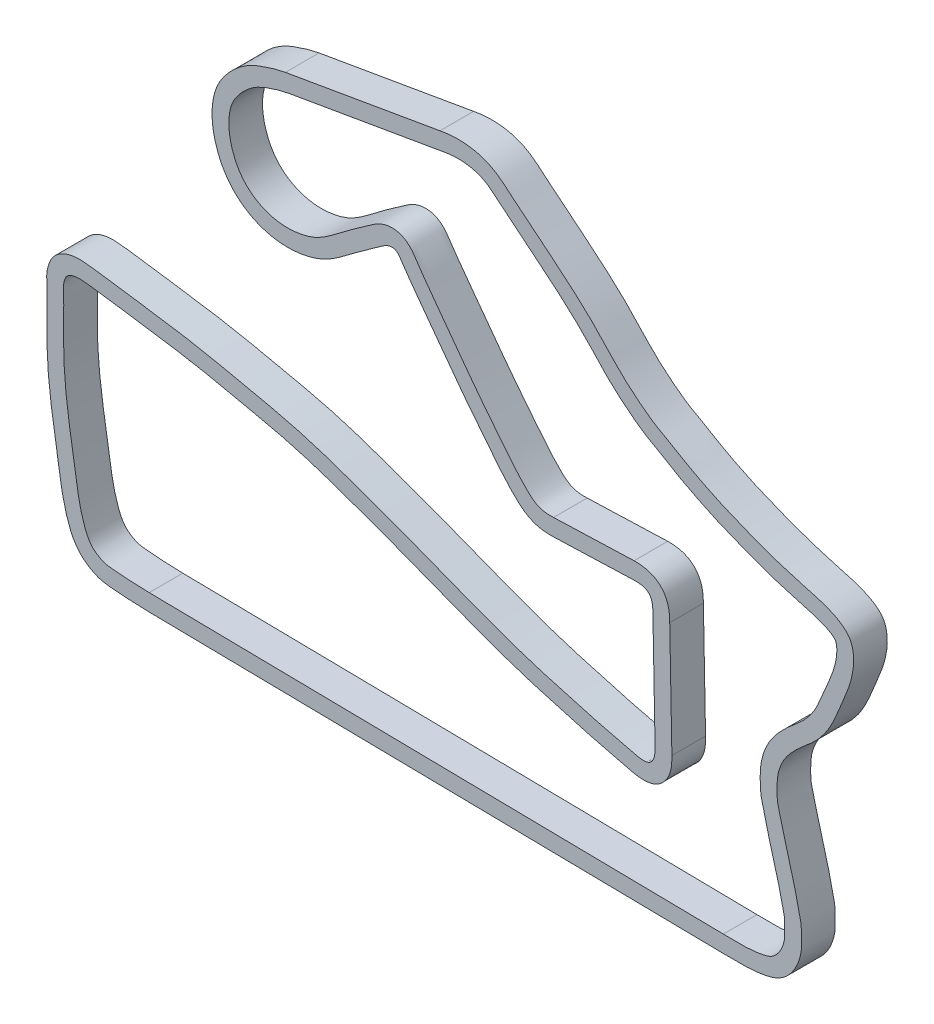
from build123d import *

# Parameters (mm, degrees)
BOSS_EXTRUDE1_DEPTH = 25.4
SCALE1_SCALE        = 1.5


with BuildPart() as part:
    # Sketch1 → Boss-Extrude1 (new body)
    with BuildSketch(Plane.XY):
        with BuildLine():
            Line((510.948052258, 0), (77.568867003, 6.513353528))
            add(Edge.make_bspline(
                [(77.568867003, 6.513353528), (69.030728587, 6.641675137), (55.964005037, 7.369579283), (40.619041764, 8.962681121), (32.520389831, 13.062197763), (22.340509454, 20.632128838), (13.37293322, 40.995751909), (9.64727267, 68.132555503), (4.518112533, 98.566856348), (0.888212171, 127.345546067), (0.243313676, 155.813105447), (0.796433318, 176.596094605), (0.231593183, 189.683032719), (1.817976997, 195.772330326), (3.969365909, 201.111279782), (8.445075768, 206.051727156), (15.426999324, 209.808150677), (25.187426391, 211.339964649), (48.241253614, 208.234524629), (77.101494294, 204.087879138), (114.230932258, 198.475524376), (150.520531401, 190.553781654), (190.249150629, 182.194634337), (246.070987082, 163.295131018), (294.761597926, 144.48794029), (340.355184506, 126.646570623), (368.949494388, 116.994564879), (398.232954792, 108.82512586), (423.483106585, 101.891766343), (439.265784543, 98.319066993), (447.287916927, 96.186627876), (451.586233083, 95.942868872), (456.007298367, 96.71723885), (459.710546879, 101.967401294), (459.673627387, 107.096180764), (459.622470964, 109.787147582)],
                knots=[0, 0, 0, 0, 0.037553743, 0.051675274, 0.06341315, 0.074522355, 0.103523939, 0.15100199, 0.188457487, 0.230816561, 0.270760544, 0.305807001, 0.316980103, 0.3244308, 0.331625629, 0.340566304, 0.351322267, 0.363770868, 0.380669469, 0.446973148, 0.484528158, 0.535660665, 0.600414836, 0.652006859, 0.778824976, 0.816085081, 0.854228161, 0.903418232, 0.941675071, 0.962299193, 0.97037132, 0.975801833, 0.980081757, 0.988237124, 1, 1, 1, 1], degree=3))
            Line((459.622470964, 109.787147582), (457.987392708, 195.796705296))
            add(Edge.make_bspline(
                [(457.987392708, 195.796705296), (457.967490098, 196.843636645), (457.891662231, 198.896187568), (457.622623229, 201.827375913), (456.841412297, 204.671863441), (455.213625657, 207.490902585), (452.287680225, 209.324394914), (448.50392316, 210.233281687), (445.799968277, 210.415413959), (444.208360226, 210.360282958)],
                knots=[0, 0, 0, 0, 0.133759242, 0.259768248, 0.37304448, 0.506547964, 0.662787354, 0.794589909, 1, 1, 1, 1], degree=3))
            Line((444.208360226, 210.360282958), (383.443399876, 208.255472584))
            add(Edge.make_bspline(
                [(383.443399876, 208.255472584), (380.654226775, 208.15885966), (375.280764537, 208.163684824), (368.045334419, 209.957056426), (362.170112945, 212.983787892), (357.684334704, 216.390098997), (348.113215785, 225.347373543), (338.01326167, 237.992346732), (324.805335562, 254.602800783), (312.246963495, 270.660217661), (298.545736406, 289.442546536), (284.590190359, 308.224393568), (274.527618279, 321.963789608), (268.593941791, 330.548653617), (266.155483312, 334.362737176), (263.593299438, 336.497895803), (260.420108869, 336.858659488), (256.39910491, 335.719713316), (250.553914429, 331.361866757), (242.307412942, 325.802938943), (227.864562545, 315.24259751), (213.952537761, 303.809529439), (192.000062158, 296.908188226), (171.08149331, 296.360499132), (150.238977452, 305.175550348), (135.871318743, 318.917286155), (126.943320823, 337.291444998), (124.032158765, 357.594312144), (127.954304381, 376.191172031), (138.033269758, 390.521313405), (151.276548221, 401.562382496), (166.686521311, 407.312033441), (176.222002931, 409.941038251), (180.596038986, 410.696409758)],
                knots=[0, 0, 0, 0, 0.018810889, 0.03554016, 0.049383709, 0.062730234, 0.073095707, 0.13702697, 0.170537904, 0.215175917, 0.273365218, 0.326069889, 0.371729283, 0.387280673, 0.395894573, 0.40198787, 0.408845865, 0.416254491, 0.429510372, 0.457056778, 0.483027139, 0.549403055, 0.57496845, 0.635951455, 0.684859285, 0.72240142, 0.766603351, 0.819026654, 0.85694758, 0.890594014, 0.93445833, 0.969956567, 1, 1, 1, 1], degree=3))
            Line((180.596038986, 410.696409758), (297.281003035, 430.847248938))
            add(Edge.make_bspline(
                [(297.281003035, 430.847248938), (300.034357121, 431.322737754), (306.603516737, 432.346299455), (316.916246984, 432.245606968), (328.463277027, 430.166073006), (340.273379495, 424.935961335), (354.848764078, 411.909311159), (375.404197197, 395.575288586), (397.73116387, 377.218326557), (418.162331408, 357.954190535), (432.029256665, 341.846826249), (447.325447689, 328.821935975), (459.184433634, 319.831044682), (471.65903681, 313.514496614), (480.194498146, 308.296774442), (487.526117908, 303.872620687), (495.840819778, 299.725991428), (506.762410547, 294.195534394), (531.087772775, 283.934775855), (559.595055945, 273.36219233), (587.832661316, 266.798602429), (600.799391745, 260.166074984), (607.055472768, 253.834751887), (609.561604572, 245.877036708), (609.673062989, 236.021877094), (606.677781579, 222.094884874), (600.265705095, 207.771615283), (594.883618797, 194.295463346), (588.639541784, 182.635257129), (579.781471959, 171.977727336), (569.572098995, 164.231918965), (562.566691985, 157.06555921), (558.130924613, 151.848679425), (554.851305595, 145.800111699), (551.915420971, 137.970335053), (551.56761943, 129.123301291), (551.742066227, 119.157654193), (554.175446648, 111.369336951), (556.801225502, 100.231330927), (560.757801353, 85.134073054), (565.586299765, 68.767121719), (568.235700017, 55.948491994), (570.157436182, 47.920362657), (570.043428432, 40.359634956), (570.468170493, 32.054965541), (568.446302353, 23.756378752), (565.074127328, 16.39731597), (559.983589885, 9.554118765), (552.489040221, 3.880670293), (543.093075462, 1.411022084), (529.190090122, -0.441241168), (518.595728753, -0.114938655), (510.948052258, 0)],
                knots=[0, 0, 0, 0, 0.0122747, 0.029125367, 0.04500914, 0.063545861, 0.084923288, 0.130314231, 0.179055588, 0.211691381, 0.25352597, 0.27204927, 0.299843856, 0.318569353, 0.333311676, 0.343765783, 0.356145831, 0.374083225, 0.397503071, 0.472003458, 0.507370569, 0.524214459, 0.535352764, 0.545335874, 0.559970477, 0.578222887, 0.607407655, 0.628665351, 0.641923049, 0.66534492, 0.68877601, 0.697981987, 0.709327812, 0.718686907, 0.728065134, 0.745775031, 0.757063316, 0.771668458, 0.781283631, 0.807363115, 0.840162181, 0.856109978, 0.864893489, 0.876245051, 0.889154013, 0.901241586, 0.913299075, 0.924502134, 0.938411877, 0.953595749, 0.966528787, 1, 1, 1, 1], degree=3))
        make_face()
        with BuildLine():
            Line((511.13890187, 12.69856592), (77.759716614, 19.211919448))
            add(Edge.make_bspline(
                [(77.759716614, 19.211919448), (76.900187637, 19.224837503), (75.196484109, 19.258428994), (71.667894876, 19.358907419), (67.14494168, 19.544205338), (62.51141537, 19.805373157), (58.781490632, 20.057073316), (55.976679843, 20.266538582), (53.191893239, 20.495941716), (50.368986188, 20.744621678), (47.926208197, 21.00125836), (45.89002905, 21.316358467), (44.537827154, 21.635998419), (43.659684698, 21.913908674), (42.695256641, 22.275130119), (41.382392445, 22.876591141), (39.949188326, 23.676396867), (38.742966589, 24.428003032), (37.624267557, 25.17412558), (36.374228779, 26.109737694), (35.361342747, 27.013250172), (34.665914078, 27.732582794), (33.611629618, 28.934811625), (32.078897563, 31.131898644), (30.176864869, 34.921367161), (28.478043374, 39.409796012), (26.975094987, 44.305885307), (25.714430135, 49.270355901), (24.267553429, 56.098940403), (23.08659907, 63.209849999), (21.960236521, 70.613353778), (20.782440028, 78.186003573), (19.269555092, 87.526081779), (16.939940291, 102.320774916), (14.99122472, 116.924620528), (13.785185068, 131.349212059), (13.294861216, 142.257588427), (13.154680282, 151.4465668), (13.171902076, 158.815431895), (13.230958635, 164.428983577), (13.291036057, 170.142330198), (13.306329744, 174.987229109), (13.273871885, 178.922861692), (13.231298764, 181.393743011), (13.177640098, 183.4120204), (13.125849131, 185.225541961), (13.113069224, 186.735581431), (13.164206275, 187.927797403), (13.230604752, 188.655227819), (13.319662193, 189.248626867), (13.471446656, 189.981809608), (13.681655533, 190.786937932), (13.962039468, 191.699427306), (14.277253478, 192.606690638), (14.55074403, 193.285904798), (14.796575145, 193.798366106), (14.962939796, 194.08829202), (15.166046423, 194.386209776), (15.532181549, 194.839923233), (16.148415726, 195.450095328), (17.394085725, 196.376883076), (18.975665604, 197.147856063), (20.861150204, 197.681086507), (23.03516346, 198.063756739), (26.081890211, 198.198399976), (29.859474952, 197.876751932), (33.325010287, 197.426373604), (37.095669461, 196.908088847), (41.760400906, 196.266908234), (47.370309762, 195.484361317), (54.836569312, 194.432188129), (64.162868413, 193.097381099), (75.34364728, 191.465424047), (86.546512371, 189.809904362), (97.648653251, 188.114070007), (108.590427535, 186.281483905), (123.102431508, 183.511373175), (137.786437293, 180.349776496), (152.631579571, 177.170097517), (167.286025009, 173.98431908), (181.684186483, 170.580486737), (195.697018032, 166.612298323), (209.743953621, 162.192254042), (227.407390497, 156.056122324), (248.617019222, 148.373858245), (269.747960345, 140.445724199), (287.338402574, 133.688784732), (301.416476219, 128.225032065), (311.962468764, 124.111279827), (322.586150662, 119.968223694), (333.359025168, 115.878408796), (344.291528017, 111.956096465), (355.275782909, 108.258745537), (366.341274808, 104.772547584), (377.398911339, 101.503977267), (386.587378814, 98.902479965), (393.917606215, 96.863706199), (399.394147882, 95.348706888), (404.90064869, 93.832836802), (410.440357636, 92.331196738), (416.017331438, 90.856690538), (421.626534942, 89.422750297), (426.353506779, 88.273838526), (430.055777624, 87.397285734), (432.798591233, 86.747521145), (435.497047693, 86.099877859), (437.734473452, 85.548975861), (439.459122456, 85.11073203), (440.922822041, 84.735616133), (442.585008413, 84.335750517), (444.445657923, 83.946570826), (446.522516147, 83.610931582), (448.788565614, 83.385978261), (450.82688224, 83.335437863), (452.525563882, 83.405198743), (453.859107922, 83.518684684), (455.415477321, 83.73955136), (457.169141272, 84.12716271), (459.110926045, 84.746783932), (461.265166142, 85.738959372), (463.160843302, 86.939107277), (465.349098553, 88.704810902), (467.481192952, 91.087721412), (469.302278474, 93.976487125), (470.594601855, 96.847015564), (471.456712795, 99.643231644), (471.966384903, 102.231160851), (472.231282001, 104.585528796), (472.335226637, 106.688752491), (472.345225884, 108.21621101), (472.333364108, 109.309541154), (472.32484904, 109.782759602), (472.320176719, 110.028536366)],
                knots=[0, 0, 0, 0, 0.00390625, 0.0078125, 0.015625, 0.0234375, 0.02734375, 0.03125, 0.03515625, 0.0390625, 0.04296875, 0.046875, 0.05078125, 0.052734375, 0.0546875, 0.05859375, 0.0625, 0.064453125, 0.06640625, 0.0703125, 0.07421875, 0.076171875, 0.078125, 0.0859375, 0.09375, 0.1015625, 0.109375, 0.1171875, 0.125, 0.140625, 0.1484375, 0.15625, 0.171875, 0.1875, 0.21875, 0.234375, 0.25, 0.265625, 0.2734375, 0.28125, 0.2890625, 0.296875, 0.30078125, 0.3046875, 0.306640625, 0.30859375, 0.3125, 0.314453125, 0.31640625, 0.318359375, 0.3203125, 0.322265625, 0.32421875, 0.326171875, 0.328125, 0.330078125, 0.33203125, 0.333984375, 0.3359375, 0.33984375, 0.34375, 0.3515625, 0.35546875, 0.359375, 0.3671875, 0.375, 0.37890625, 0.3828125, 0.390625, 0.3984375, 0.40625, 0.421875, 0.4375, 0.453125, 0.46875, 0.484375, 0.5, 0.53125, 0.546875, 0.5625, 0.59375, 0.609375, 0.625, 0.65625, 0.6875, 0.71875, 0.75, 0.765625, 0.78125, 0.796875, 0.8125, 0.828125, 0.84375, 0.859375, 0.875, 0.890625, 0.8984375, 0.90625, 0.9140625, 0.921875, 0.9296875, 0.9375, 0.9453125, 0.94921875, 0.953125, 0.95703125, 0.9609375, 0.962890625, 0.96484375, 0.966796875, 0.96875, 0.970703125, 0.97265625, 0.974609375, 0.975585938, 0.9765625, 0.977539062, 0.978515625, 0.979492188, 0.98046875, 0.981445312, 0.982421875, 0.984375, 0.986328125, 0.98828125, 0.990234375, 0.9921875, 0.994140625, 0.99609375, 0.998046875, 0.999023438, 1, 1, 1, 1], degree=3))
            Line((472.320176719, 110.028536366), (470.685098463, 196.03809408))
            add(Edge.make_bspline(
                [(470.685098463, 196.03809408), (470.662981455, 197.201508793), (470.603018685, 198.862493045), (470.421037485, 201.407622173), (470.126740268, 203.786867598), (469.544090522, 206.490968681), (468.593446114, 209.335150094), (467.374060337, 211.85119163), (466.012016905, 213.934975867), (464.755639118, 215.511553604), (463.271586847, 217.008718235), (461.26283395, 218.655411384), (458.699753389, 220.228375533), (455.613617819, 221.513941384), (453.297265167, 222.140310224), (451.66001998, 222.472435731), (450.173575148, 222.72131953), (447.53702416, 223.040698471), (445.275545364, 223.104865341), (443.768714258, 223.05267089)],
                knots=[0, 0, 0, 0, 0.125, 0.1875, 0.25, 0.3125, 0.375, 0.4375, 0.46875, 0.5, 0.53125, 0.5625, 0.625, 0.6875, 0.75, 0.78125, 0.8125, 0.875, 1, 1, 1, 1], degree=3))
            Line((443.768714258, 223.05267089), (383.003753909, 220.947860516))
            add(Edge.make_bspline(
                [(383.003753909, 220.947860516), (382.502580473, 220.930500593), (381.478331168, 220.902883149), (379.601879017, 220.895623584), (377.479076432, 220.990303713), (375.387100076, 221.284104517), (373.345276027, 221.802436885), (371.501072328, 222.50645579), (368.970372948, 223.815825554), (366.425306015, 225.666296009), (363.662186213, 228.180412411), (360.658912003, 231.138818527), (357.043529085, 235.005453533), (352.745909677, 240.002412182), (348.474428332, 245.248230817), (344.124520919, 250.716881773), (339.770926033, 256.188523462), (335.445961336, 261.651613226), (329.715829332, 268.938139448), (322.711076739, 278.016622487), (315.847248775, 287.286251788), (310.324826019, 294.803310867), (306.149409418, 300.473561368), (301.97500352, 306.116665389), (297.809396426, 311.744615054), (294.348581649, 316.429343146), (291.598227007, 320.16728521), (289.550219373, 322.96466121), (287.519253012, 325.75849576), (285.507575008, 328.551303828), (283.520714304, 331.341861501), (281.879212248, 333.676809717), (280.609923199, 335.510272541), (279.837568132, 336.643502683), (279.231946745, 337.545766364), (278.787979425, 338.21378769), (278.33889029, 338.900891711), (277.512825636, 340.145409786), (276.344625944, 341.772618647), (274.686142708, 343.626212436), (273.089821334, 345.123666491), (271.350891013, 346.408077964), (269.66972178, 347.371005159), (267.738546398, 348.261452043), (265.382424025, 348.974463051), (262.76455346, 349.358609994), (260.362774953, 349.403621073), (257.397998128, 349.129982003), (254.10443553, 348.298431809), (250.84296524, 346.889573119), (248.251998896, 345.379889653), (246.579196387, 344.231985824), (245.473467641, 343.43813671), (244.775979766, 342.932131474), (244.11266301, 342.456024074), (243.205850632, 341.810278709), (242.061947913, 341.00473983), (240.663823602, 340.030306782), (238.770452303, 338.718509163), (236.352380281, 337.047866658), (233.371548798, 334.954533123), (230.42341795, 332.832063733), (227.498378765, 330.68058667), (223.601609148, 327.750853401), (218.938739, 324.151895537), (213.632623677, 320.216489474), (208.530267502, 316.84555457), (204.428884681, 314.639956445), (201.183629814, 313.268574431), (197.731294573, 312.057559302), (193.104944962, 310.870017792), (185.499365823, 309.723785789), (177.896298387, 309.803438272), (170.678465931, 311.155426638), (165.436476263, 312.825605755), (160.471948996, 315.120659682), (155.913887795, 317.984868051), (151.781414515, 321.422243105), (148.164394615, 325.348458955), (145.136737125, 329.700750574), (141.719127198, 336.239767159), (138.688617922, 345.510022405), (137.690203905, 354.839133572), (138.213252244, 362.193097538), (139.099815074, 366.477118459), (140.142813165, 369.62242127), (141.377802802, 372.5059434), (143.501284809, 376.112981914), (146.392290919, 379.745526871), (149.007673301, 382.529277794), (151.726899702, 385.120514926), (154.609031161, 387.42827164), (157.617565938, 389.408235423), (160.666134333, 391.14006357), (164.953733298, 393.071926594), (169.874412073, 394.7914917), (174.031306621, 396.08673725), (177.033021408, 396.933601401), (179.468403231, 397.529314951), (181.369304195, 397.929625993), (182.291173013, 398.101162909), (182.757267024, 398.181654732)],
                knots=[0, 0, 0, 0, 0.00390625, 0.0078125, 0.015625, 0.0234375, 0.03125, 0.0390625, 0.046875, 0.0625, 0.0703125, 0.078125, 0.09375, 0.109375, 0.125, 0.140625, 0.15625, 0.171875, 0.1875, 0.21875, 0.25, 0.265625, 0.28125, 0.296875, 0.3125, 0.328125, 0.3359375, 0.34375, 0.3515625, 0.359375, 0.3671875, 0.375, 0.37890625, 0.3828125, 0.384765625, 0.38671875, 0.388671875, 0.390625, 0.39453125, 0.396484375, 0.3984375, 0.400390625, 0.401367188, 0.40234375, 0.404296875, 0.40625, 0.408203125, 0.41015625, 0.4140625, 0.41796875, 0.421875, 0.42578125, 0.427734375, 0.4296875, 0.431640625, 0.43359375, 0.4375, 0.44140625, 0.4453125, 0.453125, 0.4609375, 0.46875, 0.4765625, 0.484375, 0.5, 0.515625, 0.53125, 0.546875, 0.5546875, 0.5625, 0.578125, 0.59375, 0.625, 0.640625, 0.65625, 0.671875, 0.6875, 0.703125, 0.71875, 0.734375, 0.75, 0.78125, 0.8125, 0.828125, 0.84375, 0.8515625, 0.859375, 0.875, 0.890625, 0.8984375, 0.90625, 0.921875, 0.9296875, 0.9375, 0.953125, 0.96875, 0.9765625, 0.984375, 0.9921875, 0.99609375, 1, 1, 1, 1], degree=3))
            Line((182.757267024, 398.181654732), (299.442231073, 418.332493912))
            add(Edge.make_bspline(
                [(299.442231073, 418.332493912), (299.853053267, 418.403440602), (300.683081164, 418.544526922), (302.281220861, 418.803049115), (304.985150787, 419.196199635), (308.463826153, 419.52002616), (312.740603416, 419.539216626), (317.075671535, 419.200923419), (321.22131779, 418.524137809), (325.080611656, 417.495807855), (328.154193541, 416.302951019), (330.482315978, 415.162157478), (332.144565678, 414.222874956), (333.732701582, 413.192406283), (335.419345003, 411.96753921), (337.177452406, 410.578608968), (339.026822253, 409.033293471), (340.967728502, 407.360489876), (343.742093371, 404.96030917), (347.246822509, 401.994409384), (351.443930518, 398.514373913), (357.037757013, 393.948114173), (363.994580941, 388.353021592), (372.225492115, 381.704410661), (380.337316707, 375.014773873), (388.274269034, 368.248010081), (395.986974517, 361.357805907), (403.427976365, 354.302751965), (410.430973278, 347.069897691), (417.665635606, 339.1806174), (424.162370632, 332.414770188), (429.870677837, 327.08297859), (434.204517412, 323.329482934), (438.520722835, 319.776303545), (442.975675569, 316.254611739), (447.676482786, 312.784491497), (451.796385364, 310.013196172), (455.281876417, 307.881371249), (457.852740946, 306.410003243), (460.33004498, 305.048226088), (462.704403296, 303.765509699), (464.966528005, 302.535357489), (467.780083444, 300.953607575), (470.68333268, 299.22312454), (473.685241983, 297.401141008), (476.00017056, 295.99486179), (478.430483726, 294.544265546), (481.017554493, 293.062742393), (483.64678095, 291.651702428), (487.021494288, 289.922781725), (490.953560852, 287.959030785), (495.817678079, 285.517139848), (500.900258408, 283.069163736), (506.040826732, 280.757611952), (511.136116449, 278.581954499), (516.173819375, 276.504931293), (526.249742336, 272.430598986), (538.200640445, 267.883584424), (552.151749306, 263.190944541), (561.002867849, 260.504921033), (568.18500813, 258.545165261), (575.014854435, 256.739574513), (582.843335824, 254.475520891), (589.721534284, 251.638846368), (593.112933265, 249.472872729), (594.654142, 248.186218235), (595.278876661, 247.524355044), (595.59039009, 247.119428912), (595.724558716, 246.912527847), (595.826273007, 246.725569957), (596.029115207, 246.273042384), (596.3091696, 245.419553211), (596.704477314, 243.458032096), (596.891858246, 240.686676292), (596.617511713, 236.732415996), (595.907162963, 232.616325994), (594.801986067, 228.387595035), (593.338459612, 224.043559168), (591.562271989, 219.500947271), (589.893055875, 215.536895874), (588.494487613, 212.245278158), (587.070118521, 208.849091666), (585.394653164, 204.786448203), (583.417614447, 200.215283278), (581.38326665, 195.987897034), (579.229233622, 192.138914844), (576.864559698, 188.63643364), (574.144108874, 185.247903257), (571.65062769, 182.603175509), (569.524007464, 180.595330991), (567.159446547, 178.495175605), (564.507012879, 176.263833157), (561.64054395, 173.804371682), (559.407479987, 171.814885985), (557.137695857, 169.654883632), (554.9919355, 167.465994582), (552.961829058, 165.280582211), (550.860212959, 162.87692869), (548.743144972, 160.202782954), (546.666832797, 157.160518664), (544.890766922, 154.058997672), (543.380757626, 150.978025658), (542.033659165, 147.775676554), (540.844806686, 144.285349595), (539.937737031, 140.527027223), (539.398557215, 136.980120765), (539.101296629, 133.602021687), (538.994702134, 130.958025956), (538.958378379, 128.936396952), (538.947999884, 127.495437676), (538.948993862, 126.011262845), (538.981212455, 123.922547315), (539.084080728, 121.685176283), (539.312463433, 119.311771806), (539.65741388, 116.814091022), (540.240756603, 113.953011083), (541.018035368, 110.918615728), (541.767763114, 108.235407703), (542.37763729, 105.962382555), (542.979616472, 103.518254617), (543.603880844, 100.917882985), (544.260125479, 98.245517722), (545.146710652, 94.716290813), (546.289271049, 90.308829344), (547.705249714, 85.043448731), (549.165601075, 79.80205948), (550.609808082, 74.680666666), (551.995685336, 69.653694588), (553.289249081, 64.702419445), (554.237777368, 60.679383497), (554.984219605, 57.291133018), (555.554075318, 54.679686225), (556.049558556, 52.438740865), (556.46601554, 50.621908264), (556.825413775, 49.039908048), (557.088077564, 47.713063548), (557.223737009, 46.757821153), (557.323785243, 45.71632758), (557.396368118, 44.03815146), (557.41043733, 41.950900253), (557.438137779, 39.971575964), (557.481495346, 38.126412165), (557.52427598, 36.09881135), (557.488290766, 34.08559238), (557.35713107, 32.604885091), (557.073703663, 30.997829615), (556.634838536, 29.295233017), (556.037628386, 27.49711707), (555.339415434, 25.765756033), (554.54929009, 24.125098511), (553.368840516, 22.04962925), (552.04228795, 20.222391105), (550.620566638, 18.70245963), (549.476431517, 17.679675147), (548.284554209, 16.80054703), (547.09444172, 16.091208252), (545.883933669, 15.529625641), (543.832365605, 14.792349691), (541.213232483, 14.161858189), (538.22254965, 13.6275338), (535.241446605, 13.195135022), (531.427187518, 12.819456685), (526.661215373, 12.596768777), (521.69168623, 12.545202194), (517.38451749, 12.594656539), (513.851192812, 12.654479164), (512.039242203, 12.685034502), (511.13890187, 12.69856592)],
                knots=[0, 0, 0, 0, 0.001953125, 0.00390625, 0.0078125, 0.015625, 0.0234375, 0.03125, 0.0390625, 0.046875, 0.0546875, 0.05859375, 0.0625, 0.06640625, 0.0703125, 0.07421875, 0.078125, 0.08203125, 0.0859375, 0.09375, 0.1015625, 0.109375, 0.125, 0.140625, 0.15625, 0.171875, 0.1875, 0.203125, 0.21875, 0.234375, 0.25, 0.2578125, 0.265625, 0.2734375, 0.28125, 0.2890625, 0.296875, 0.30078125, 0.3046875, 0.30859375, 0.3125, 0.31640625, 0.3203125, 0.328125, 0.33203125, 0.3359375, 0.33984375, 0.34375, 0.34765625, 0.3515625, 0.359375, 0.3671875, 0.375, 0.3828125, 0.390625, 0.3984375, 0.40625, 0.4375, 0.453125, 0.46875, 0.4765625, 0.484375, 0.5, 0.515625, 0.5234375, 0.52734375, 0.53125, 0.533203125, 0.53515625, 0.537109375, 0.5390625, 0.54296875, 0.546875, 0.5546875, 0.5625, 0.5703125, 0.578125, 0.5859375, 0.59375, 0.6015625, 0.60546875, 0.609375, 0.6171875, 0.625, 0.6328125, 0.640625, 0.6484375, 0.65625, 0.6640625, 0.66796875, 0.671875, 0.6796875, 0.68359375, 0.6875, 0.69140625, 0.6953125, 0.69921875, 0.703125, 0.70703125, 0.7109375, 0.71484375, 0.71875, 0.72265625, 0.7265625, 0.73046875, 0.734375, 0.73828125, 0.7421875, 0.744140625, 0.74609375, 0.748046875, 0.75, 0.75390625, 0.755859375, 0.7578125, 0.76171875, 0.765625, 0.76953125, 0.7734375, 0.77734375, 0.78125, 0.78515625, 0.7890625, 0.796875, 0.8046875, 0.8125, 0.8203125, 0.828125, 0.8359375, 0.84375, 0.84765625, 0.8515625, 0.85546875, 0.857421875, 0.859375, 0.86328125, 0.865234375, 0.8671875, 0.87109375, 0.875, 0.876953125, 0.87890625, 0.8828125, 0.88671875, 0.890625, 0.89453125, 0.8984375, 0.90234375, 0.90625, 0.91015625, 0.9140625, 0.921875, 0.92578125, 0.9296875, 0.93359375, 0.9375, 0.94140625, 0.9453125, 0.953125, 0.95703125, 0.9609375, 0.96875, 0.9765625, 0.984375, 0.9921875, 0.99609375, 1, 1, 1, 1], degree=3))
        make_face(mode=Mode.SUBTRACT)
    extrude(amount=BOSS_EXTRUDE1_DEPTH)


with BuildPart() as part_1:
    # Scale1: scaled about (0, 0, 0)
    add(part.part.scale(SCALE1_SCALE))


solid = part_1.part
